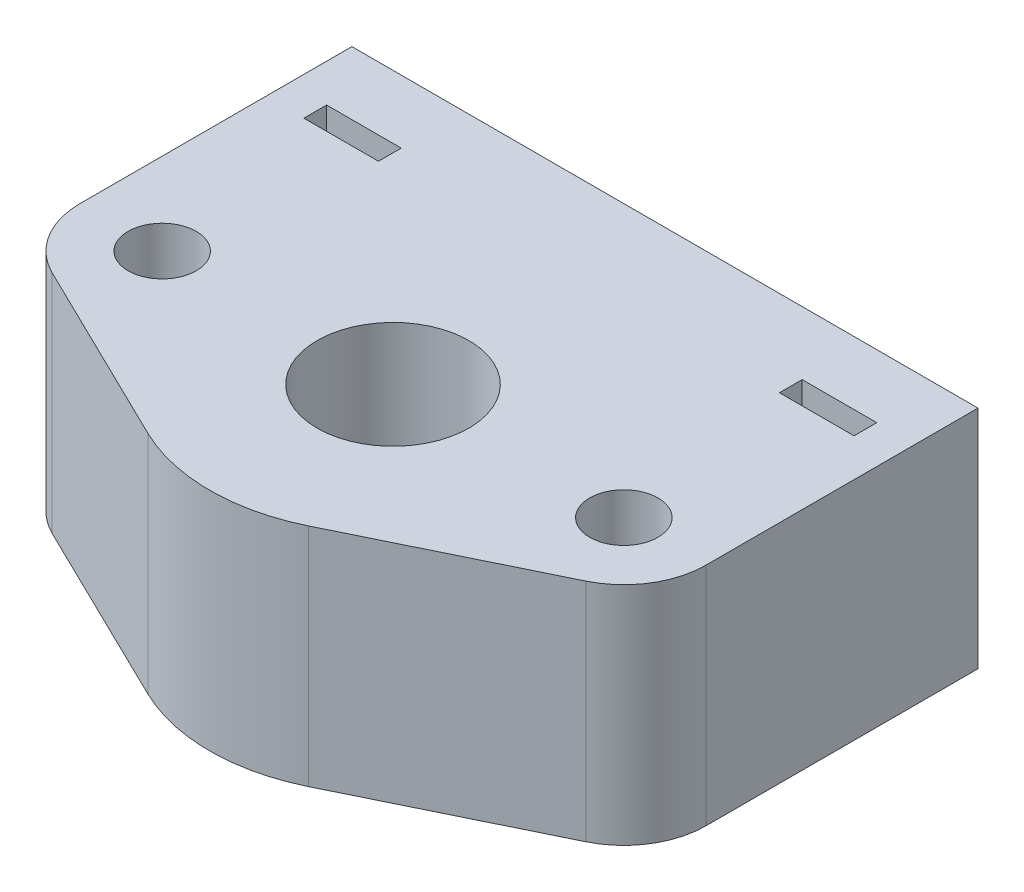
from build123d import *
from build123d.topology import SkipClean

# Parameters (mm, degrees)
BOSS_EXTRUDE1_DEPTH      = 11.9
BOSS_EXTRUDE1_DEPTH_BACK = 5.95
SKETCH1_R                = 2.7
SKETCH3_R                = 1.7
CUT_EXTRUDE1_DEPTH       = 10
CUT_EXTRUDE2_START       = -5
CUT_EXTRUDE2_DEPTH       = 1.8
CUT_EXTRUDE3_DEPTH       = 10


with BuildPart() as part:
    # Sketch1 → Boss-Extrude1 (new, two sides: drawn at the far end of the back side and taken through both)
    with BuildSketch(Plane(origin=(0, 0, 0), x_dir=(1, 0, 0), z_dir=(0, 1, 0)).offset(-BOSS_EXTRUDE1_DEPTH_BACK)):
        with BuildLine():
            Line((-24.75, 0), (-24.75, -21.5))
            ThreePointArc((-24.75, -21.5), (-23.762283916, -24.944521161), (-21.099315068, -27.342208798))
            Line((-21.099315068, -27.342208798), (-6.356164384, -34.532619627))
            ThreePointArc((-6.356164384, -34.532619627), (-3.261672532, -35.628393125), (0, -36))
            Line((0, -36), (0, -27.5))
            ThreePointArc((0, -27.5), (-6, -21.5), (0, -15.5))
            Line((0, -15.5), (0, 0))
            Line((0, 0), (-24.75, 0))
        make_face()
        with Locations(Location((-18.25, -21.5, 0), (0, 0, 270))):
            Circle(SKETCH1_R, mode=Mode.SUBTRACT)
    extrude(amount=BOSS_EXTRUDE1_DEPTH + BOSS_EXTRUDE1_DEPTH_BACK)

    # Sketch3 → Cut-Extrude1 (cut)
    with BuildSketch(Plane(origin=(0, 0, 0), x_dir=(-1, 0, 0), z_dir=(0, 0, -1))):
        with Locations((18.8, 5.95)):
            Circle(SKETCH3_R)
        with BuildLine():
            Line((0, 1.7), (0, -1.7))
            ThreePointArc((0, -1.7), (1.7, 0), (0, 1.7))
        make_face()
    extrude(amount=-CUT_EXTRUDE1_DEPTH, mode=Mode.SUBTRACT)

    # Sketch4 → Cut-Extrude2 (cut)
    with BuildSketch(Plane(origin=(0, 0, 0), x_dir=(-1, 0, 0), z_dir=(0, 0, -1)).offset(CUT_EXTRUDE2_START)):
        Polygon((15.85, 8.9), (15.85, 11.9), (21.75, 11.9), (21.75, 8.9), (21.75, 3), (15.85, 3), align=None)
        Polygon((0, 2.95), (2.95, 2.95), (2.95, 0), (2.95, -5.95), (0, -5.95), align=None)
    extrude(amount=-CUT_EXTRUDE2_DEPTH, mode=Mode.SUBTRACT)

    # Sketch6 → Cut-Extrude3 (cut)
    with BuildSketch(Plane.XZ.offset(5.95)):
        Polygon((-14, 23.953738644), (-18.25, 26.407477288), (-22.5, 23.953738644), (-22.5, 19.046261356), (-18.25, 16.592522712), (-14, 19.046261356), align=None)
    extrude(amount=-CUT_EXTRUDE3_DEPTH, mode=Mode.SUBTRACT)

    # Mirror1: part across plane


with BuildPart() as part_1:
    with SkipClean():  # the faces are left unmerged after this step: merging them gives an invalid solid
        add(part.part)
        add(part.part.mirror(Plane(origin=(0, -5.95, 0), x_dir=(0, 0, 1), z_dir=(1, 0, 0))))


solid = part_1.part
